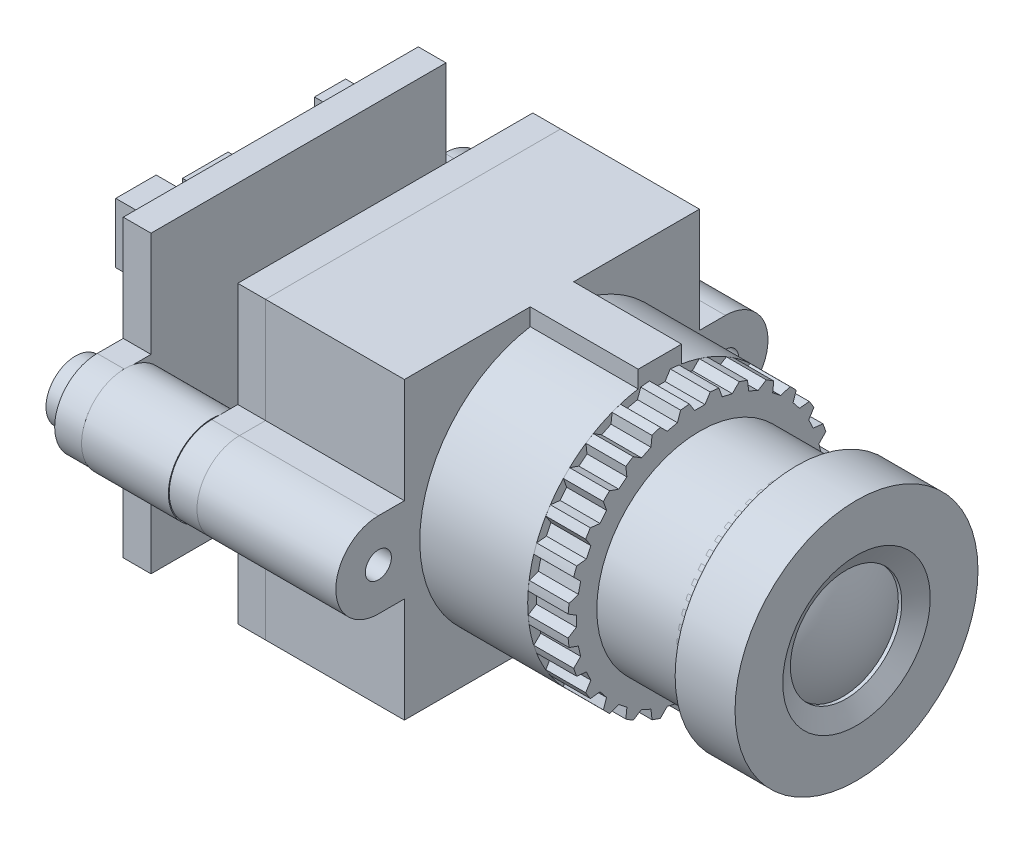
from build123d import *

# Parameters (mm, degrees)
SKETCH1_R             = 7
BOSS_EXTRUDE1_DEPTH   = 3.45
SKETCH2_R             = 5.935
BOSS_EXTRUDE2_DEPTH   = 5.58
SKETCH3_R             = 7.61
BOSS_EXTRUDE3_DEPTH   = 2.3
SKETCH4_W             = 0.6
SKETCH4_H             = 4.25
CUT_EXTRUDE1_DEPTH    = 2.3
BOSS_EXTRUDE4_DEPTH   = 6.22
SKETCH7_R             = 0.75
BOSS_EXTRUDE5_DEPTH   = 8
SKETCH8_R             = 0.75
BOSS_EXTRUDE6_DEPTH   = 1.6
SKETCH9_R             = 2.5
SKETCH9_R_2           = 1
BOSS_EXTRUDE7_DEPTH   = 5
BOSS_EXTRUDE7_2_DEPTH = 5
SKETCH10_R            = 0.75
BOSS_EXTRUDE8_DEPTH   = 1.6
SKETCH11_W            = 7
SKETCH11_H            = 3.2
BOSS_EXTRUDE9_DEPTH   = 4.8
SKETCH12_W            = 6.3
SKETCH12_H            = 2.5
CUT_EXTRUDE2_DEPTH    = 4.4
SKETCH13_W            = 4.8
SKETCH13_H            = 0.35
CUT_EXTRUDE3_DEPTH    = 1.5
SKETCH14_W            = 2.3306508
SKETCH14_H            = 3.458981743
SKETCH14_W_2          = 2.293656343
SKETCH14_H_2          = 3.939909685
SKETCH14_W_3          = 1.627756114
SKETCH14_H_3          = 1.923711771
SKETCH14_W_4          = 4.2728598
SKETCH14_H_4          = 1.960706228
SKETCH14_W_5          = 1.794231171
SKETCH14_H_5          = 2.793081515
SKETCH14_W_6          = 2.626606457
SKETCH14_H_6          = 1.331800458
BOSS_EXTRUDE10_DEPTH  = 2.2
SKETCH15_R            = 1.7
BOSS_EXTRUDE11_DEPTH  = 1.25
SKETCH16_R            = 5.935
BOSS_EXTRUDE12_DEPTH  = 1


with BuildPart() as part:
    # Sketch1 → Boss-Extrude1 (new body)
    with BuildSketch(Plane(origin=(0, 0, 0), x_dir=(0, 0, -1), z_dir=(1, 0, 0))):
        Circle(SKETCH1_R)
    extrude(amount=-BOSS_EXTRUDE1_DEPTH)

    # Sketch2 → Boss-Extrude2 (add)
    with BuildSketch(Plane.ZY.offset(3.45)):
        with Locations(Location((0, 0, 0), (0, 0, 180))):
            Circle(SKETCH2_R)
    extrude(amount=BOSS_EXTRUDE2_DEPTH)

    # Sketch3 → Boss-Extrude3 (add)
    with BuildSketch(Plane.ZY.offset(9.03)):
        Circle(SKETCH3_R)
    extrude(amount=BOSS_EXTRUDE3_DEPTH)

    # Sketch4 → Cut-Revolve7 (revolve, cut)
    with BuildSketch(Plane.XY, mode=Mode.PRIVATE) as cut_revolve7_sk:
        with BuildLine():
            Line((-0.6, 2.803361203), (-0.6, 3.210769515))
            Line((-0.6, 3.210769515), (-0.8, 3.210769515))
            add(Edge.make_bspline(
                [(-0.6, 2.803361203), (-0.692820323, 3.008825328), (-0.8, 3.210769515)],
                knots=[0.866025404, 0.866025404, 0.866025404, 1, 1, 1], degree=2))
        make_face()
        with Locations((0.3, 2.125)):
            Rectangle(SKETCH4_W, SKETCH4_H)
        with BuildLine():
            Line((0, 0), (0, 4.25))
            Line((0, 4.25), (-0.6, 3.210769515))
            Line((-0.6, 3.210769515), (-0.6, 2.803361203))
            add(Edge.make_bspline(
                [(0, 0), (0, 1.475220219), (-0.6, 2.803361203)],
                knots=[0, 0, 0, 0.866025404, 0.866025404, 0.866025404], degree=2))
        make_face()
    revolve(cut_revolve7_sk.sketch.rotate(Axis((-11.8965, 0, 0), (1, 0, 0)), 90), axis=Axis((-11.8965, 0, 0), (1, 0, 0)), mode=Mode.SUBTRACT)

    # Sketch5 → Cut-Extrude1 (cut)
    with BuildSketch(Plane(origin=(-9.03, 0, 0), x_dir=(0, 0, -1), z_dir=(1, 0, 0))):
        with BuildLine():
            ThreePointArc((3.832157886, 6.574698923), (3.301855255, 6.856373085), (2.750995245, 7.09535941))
            Line((2.750995245, 7.09535941), (2.814622725, 6.536053773))
            Line((2.814622725, 6.536053773), (3.355204045, 6.275723529))
            Line((3.355204045, 6.275723529), (3.832157886, 6.574698923))
        make_face()
        with BuildLine():
            ThreePointArc((2.273069542, 7.262592847), (1.693384307, 7.419201412), (1.103156048, 7.529617967))
            Line((1.103156048, 7.529617967), (1.289645467, 6.998493736))
            Line((1.289645467, 6.998493736), (1.874602214, 6.864981175))
            Line((1.874602214, 6.864981175), (2.273069542, 7.262592847))
        make_face()
        with BuildLine():
            ThreePointArc((0.6, 7.586310038), (0.300233748, 7.604075203), (0, 7.61))
            Line((0, 7.61), (0, 7.11))
            Line((0, 7.11), (0.3, 7.11))
            Line((0.3, 7.11), (0.6, 7.586310038))
        make_face()
        with BuildLine():
            Line((-1.289645467, 6.998493736), (-1.103156048, 7.529617967))
            ThreePointArc((-1.103156048, 7.529617967), (-1.693384307, 7.419201412), (-2.273069542, 7.262592847))
            Line((-2.273069542, 7.262592847), (-1.874602214, 6.864981175))
            Line((-1.874602214, 6.864981175), (-1.289645467, 6.998493736))
        make_face()
        with BuildLine():
            Line((0, 7.11), (0, 7.61))
            ThreePointArc((0, 7.61), (-0.300233748, 7.604075203), (-0.6, 7.586310038))
            Line((-0.6, 7.586310038), (-0.3, 7.11))
            Line((-0.3, 7.11), (0, 7.11))
        make_face()
        with BuildLine():
            Line((-2.814622725, 6.536053773), (-2.750995245, 7.09535941))
            ThreePointArc((-2.750995245, 7.09535941), (-3.301855255, 6.856373085), (-3.832157886, 6.574698923))
            Line((-3.832157886, 6.574698923), (-3.355204045, 6.275723529))
            Line((-3.355204045, 6.275723529), (-2.814622725, 6.536053773))
        make_face()
        with BuildLine():
            Line((-4.198463046, 5.745868781), (-4.260888053, 6.305309905))
            ThreePointArc((-4.260888053, 6.305309905), (-4.744757392, 5.949737582), (-5.199085832, 5.557122143))
            Line((-5.199085832, 5.557122143), (-4.667561936, 5.3717749))
            Line((-4.667561936, 5.3717749), (-4.198463046, 5.745868781))
        make_face()
        with BuildLine():
            Line((-5.3717749, 4.667561936), (-5.557122143, 5.199085832))
            ThreePointArc((-5.557122143, 5.199085832), (-5.949737582, 4.744757392), (-6.305309905, 4.260888053))
            Line((-6.305309905, 4.260888053), (-5.745868781, 4.198463046))
            Line((-5.745868781, 4.198463046), (-5.3717749, 4.667561936))
        make_face()
        with BuildLine():
            Line((-6.275723529, 3.355204045), (-6.574698923, 3.832157886))
            ThreePointArc((-6.574698923, 3.832157886), (-6.856373085, 3.301855255), (-7.09535941, 2.750995245))
            Line((-7.09535941, 2.750995245), (-6.536053773, 2.814622725))
            Line((-6.536053773, 2.814622725), (-6.275723529, 3.355204045))
        make_face()
        with BuildLine():
            Line((-6.864981175, 1.874602214), (-7.262592847, 2.273069542))
            ThreePointArc((-7.262592847, 2.273069542), (-7.419201412, 1.693384307), (-7.529617967, 1.103156048))
            Line((-7.529617967, 1.103156048), (-6.998493736, 1.289645467))
            Line((-6.998493736, 1.289645467), (-6.864981175, 1.874602214))
        make_face()
        with BuildLine():
            Line((-7.11, 0.3), (-7.586310038, 0.6))
            ThreePointArc((-7.586310038, 0.6), (-7.61, 0), (-7.586310038, -0.6))
            Line((-7.586310038, -0.6), (-7.11, -0.3))
            Line((-7.11, -0.3), (-7.11, 0.3))
        make_face()
        with BuildLine():
            ThreePointArc((-7.529617967, -1.103156048), (-7.419201412, -1.693384307), (-7.262592847, -2.273069542))
            Line((-7.262592847, -2.273069542), (-6.864981175, -1.874602214))
            Line((-6.864981175, -1.874602214), (-6.998493736, -1.289645467))
            Line((-6.998493736, -1.289645467), (-7.529617967, -1.103156048))
        make_face()
        with BuildLine():
            ThreePointArc((-7.09535941, -2.750995245), (-6.856373085, -3.301855255), (-6.574698923, -3.832157886))
            Line((-6.574698923, -3.832157886), (-6.275723529, -3.355204045))
            Line((-6.275723529, -3.355204045), (-6.536053773, -2.814622725))
            Line((-6.536053773, -2.814622725), (-7.09535941, -2.750995245))
        make_face()
        with BuildLine():
            ThreePointArc((-6.305309905, -4.260888053), (-5.949737582, -4.744757392), (-5.557122143, -5.199085832))
            Line((-5.557122143, -5.199085832), (-5.3717749, -4.667561936))
            Line((-5.3717749, -4.667561936), (-5.745868781, -4.198463046))
            Line((-5.745868781, -4.198463046), (-6.305309905, -4.260888053))
        make_face()
        with BuildLine():
            ThreePointArc((-3.832157886, -6.574698923), (-3.301855255, -6.856373085), (-2.750995245, -7.09535941))
            Line((-2.750995245, -7.09535941), (-2.814622725, -6.536053773))
            Line((-2.814622725, -6.536053773), (-3.355204045, -6.275723529))
            Line((-3.355204045, -6.275723529), (-3.832157886, -6.574698923))
        make_face()
        with BuildLine():
            ThreePointArc((-5.199085832, -5.557122143), (-4.744757392, -5.949737582), (-4.260888053, -6.305309905))
            Line((-4.260888053, -6.305309905), (-4.198463046, -5.745868781))
            Line((-4.198463046, -5.745868781), (-4.667561936, -5.3717749))
            Line((-4.667561936, -5.3717749), (-5.199085832, -5.557122143))
        make_face()
        with BuildLine():
            ThreePointArc((-2.273069542, -7.262592847), (-1.693384307, -7.419201412), (-1.103156048, -7.529617967))
            Line((-1.103156048, -7.529617967), (-1.289645467, -6.998493736))
            Line((-1.289645467, -6.998493736), (-1.874602214, -6.864981175))
            Line((-1.874602214, -6.864981175), (-2.273069542, -7.262592847))
        make_face()
        with BuildLine():
            Line((0, -7.61), (0, -7.11))
            Line((0, -7.11), (-0.3, -7.11))
            Line((-0.3, -7.11), (-0.6, -7.586310038))
            ThreePointArc((-0.6, -7.586310038), (-0.300233748, -7.604075203), (0, -7.61))
        make_face()
        with BuildLine():
            Line((0.3, -7.11), (0, -7.11))
            Line((0, -7.11), (0, -7.61))
            ThreePointArc((0, -7.61), (0.300233748, -7.604075203), (0.6, -7.586310038))
            Line((0.6, -7.586310038), (0.3, -7.11))
        make_face()
        with BuildLine():
            Line((1.289645467, -6.998493736), (1.103156048, -7.529617967))
            ThreePointArc((1.103156048, -7.529617967), (1.693384307, -7.419201412), (2.273069542, -7.262592847))
            Line((2.273069542, -7.262592847), (1.874602214, -6.864981175))
            Line((1.874602214, -6.864981175), (1.289645467, -6.998493736))
        make_face()
        with BuildLine():
            Line((2.814622725, -6.536053773), (2.750995245, -7.09535941))
            ThreePointArc((2.750995245, -7.09535941), (3.301855255, -6.856373085), (3.832157886, -6.574698923))
            Line((3.832157886, -6.574698923), (3.355204045, -6.275723529))
            Line((3.355204045, -6.275723529), (2.814622725, -6.536053773))
        make_face()
        with BuildLine():
            Line((4.198463046, -5.745868781), (4.260888053, -6.305309905))
            ThreePointArc((4.260888053, -6.305309905), (4.744757392, -5.949737582), (5.199085832, -5.557122143))
            Line((5.199085832, -5.557122143), (4.667561936, -5.3717749))
            Line((4.667561936, -5.3717749), (4.198463046, -5.745868781))
        make_face()
        with BuildLine():
            Line((5.3717749, -4.667561936), (5.557122143, -5.199085832))
            ThreePointArc((5.557122143, -5.199085832), (5.949737582, -4.744757392), (6.305309905, -4.260888053))
            Line((6.305309905, -4.260888053), (5.745868781, -4.198463046))
            Line((5.745868781, -4.198463046), (5.3717749, -4.667561936))
        make_face()
        with BuildLine():
            Line((6.275723529, -3.355204045), (6.574698923, -3.832157886))
            ThreePointArc((6.574698923, -3.832157886), (6.856373085, -3.301855255), (7.09535941, -2.750995245))
            Line((7.09535941, -2.750995245), (6.536053773, -2.814622725))
            Line((6.536053773, -2.814622725), (6.275723529, -3.355204045))
        make_face()
        with BuildLine():
            Line((6.864981175, -1.874602214), (7.262592847, -2.273069542))
            ThreePointArc((7.262592847, -2.273069542), (7.419201412, -1.693384307), (7.529617967, -1.103156048))
            Line((7.529617967, -1.103156048), (6.998493736, -1.289645467))
            Line((6.998493736, -1.289645467), (6.864981175, -1.874602214))
        make_face()
        with BuildLine():
            ThreePointArc((7.61, 0), (7.604075203, 0.300233748), (7.586310038, 0.6))
            Line((7.586310038, 0.6), (7.11, 0.3))
            Line((7.11, 0.3), (7.11, -0.3))
            Line((7.11, -0.3), (7.586310038, -0.6))
            ThreePointArc((7.586310038, -0.6), (7.604075203, -0.300233748), (7.61, 0))
        make_face()
        with BuildLine():
            ThreePointArc((7.529617967, 1.103156048), (7.419201412, 1.693384307), (7.262592847, 2.273069542))
            Line((7.262592847, 2.273069542), (6.864981175, 1.874602214))
            Line((6.864981175, 1.874602214), (6.998493736, 1.289645467))
            Line((6.998493736, 1.289645467), (7.529617967, 1.103156048))
        make_face()
        with BuildLine():
            ThreePointArc((7.09535941, 2.750995245), (6.856373085, 3.301855255), (6.574698923, 3.832157886))
            Line((6.574698923, 3.832157886), (6.275723529, 3.355204045))
            Line((6.275723529, 3.355204045), (6.536053773, 2.814622725))
            Line((6.536053773, 2.814622725), (7.09535941, 2.750995245))
        make_face()
        with BuildLine():
            ThreePointArc((6.305309905, 4.260888053), (5.949737582, 4.744757392), (5.557122143, 5.199085832))
            Line((5.557122143, 5.199085832), (5.3717749, 4.667561936))
            Line((5.3717749, 4.667561936), (5.745868781, 4.198463046))
            Line((5.745868781, 4.198463046), (6.305309905, 4.260888053))
        make_face()
        with BuildLine():
            ThreePointArc((5.199085832, 5.557122143), (4.744757392, 5.949737582), (4.260888053, 6.305309905))
            Line((4.260888053, 6.305309905), (4.198463046, 5.745868781))
            Line((4.198463046, 5.745868781), (4.667561936, 5.3717749))
            Line((4.667561936, 5.3717749), (5.199085832, 5.557122143))
        make_face()
    extrude(amount=-CUT_EXTRUDE1_DEPTH, mode=Mode.SUBTRACT)

    # Sketch6 → Boss-Extrude4 (add)
    with BuildSketch(Plane.ZY.offset(11.33)):
        with BuildLine():
            ThreePointArc((1.25, 7.511705865), (0, 7.615), (-1.25, 7.511705865))
            Line((-1.25, 7.511705865), (1.25, 7.511705865))
        make_face()
        with BuildLine():
            Line((1.25, 7.511705865), (-1.25, 7.511705865))
            ThreePointArc((-1.25, 7.511705865), (-4.922878985, -5.809775168), (7.615, 0))
            ThreePointArc((7.615, 0), (5.809775168, 4.922878985), (1.25, 7.511705865))
        make_face()
        with BuildLine():
            Line((1.25, 8.5), (-1.25, 8.5))
            Line((-1.25, 8.5), (-1.25, 7.511705865))
            ThreePointArc((-1.25, 7.511705865), (0, 7.615), (1.25, 7.511705865))
            Line((1.25, 7.511705865), (1.25, 8.5))
        make_face()
    extrude(amount=BOSS_EXTRUDE4_DEPTH)

    # Sketch7 → Boss-Extrude5 (add)
    with BuildSketch(Plane.ZY.offset(17.55)):
        with BuildLine():
            Line((-8.5, 8.5), (-8.5, 2.45))
            Line((-8.5, 2.45), (-10, 2.45))
            ThreePointArc((-10, 2.45), (-12.45, 0), (-10, -2.45))
            Line((-10, -2.45), (-8.5, -2.45))
            Line((-8.5, -2.45), (-8.5, -8.5))
            Line((-8.5, -8.5), (8.5, -8.5))
            Line((8.5, -8.5), (8.5, -2.45))
            Line((8.5, -2.45), (10, -2.45))
            ThreePointArc((10, -2.45), (12.45, 0), (10, 2.45))
            Line((10, 2.45), (8.5, 2.45))
            Line((8.5, 2.45), (8.5, 8.5))
            Line((8.5, 8.5), (-8.5, 8.5))
        make_face()
        with Locations((-10, 0)):
            Circle(SKETCH7_R, mode=Mode.SUBTRACT)
        with Locations((10, 0)):
            Circle(SKETCH7_R, mode=Mode.SUBTRACT)
    extrude(amount=BOSS_EXTRUDE5_DEPTH)


with BuildPart() as body_2:
    # Sketch8 → Boss-Extrude6 (new body)
    with BuildSketch(Plane.ZY.offset(25.55)):
        with BuildLine():
            Line((-10, -2.45), (-8.5, -2.45))
            Line((-8.5, -2.45), (-8.5, -8.5))
            Line((-8.5, -8.5), (8.5, -8.5))
            Line((8.5, -8.5), (8.5, -2.45))
            Line((8.5, -2.45), (10, -2.45))
            ThreePointArc((10, -2.45), (12.45, 0), (10, 2.45))
            Line((10, 2.45), (8.5, 2.45))
            Line((8.5, 2.45), (8.5, 8.5))
            Line((8.5, 8.5), (-8.5, 8.5))
            Line((-8.5, 8.5), (-8.5, 2.45))
            Line((-8.5, 2.45), (-10, 2.45))
            ThreePointArc((-10, 2.45), (-12.45, 0), (-10, -2.45))
        make_face()
        with Locations((10, 0)):
            Circle(SKETCH8_R, mode=Mode.SUBTRACT)
        with Locations((-10, 0)):
            Circle(SKETCH8_R, mode=Mode.SUBTRACT)
    extrude(amount=BOSS_EXTRUDE6_DEPTH)


with BuildPart() as body_3:
    # Sketch9 → Boss-Extrude7 (new body)
    with BuildSketch(Plane.ZY.offset(27.15)):
        with Locations((-10, 0)):
            Circle(SKETCH9_R)
        with Locations((-10, 0)):
            Circle(SKETCH9_R_2, mode=Mode.SUBTRACT)
    extrude(amount=BOSS_EXTRUDE7_DEPTH)


with BuildPart() as body_4:
    # Sketch9 → Boss-Extrude7 2 (new body)
    with BuildSketch(Plane.ZY.offset(27.15)):
        with Locations(Location((10, 0, 0), (0, 0, 180))):
            Circle(SKETCH9_R)
        with Locations(Location((10, 0, 0), (0, 0, 180))):
            Circle(SKETCH9_R_2, mode=Mode.SUBTRACT)
    extrude(amount=BOSS_EXTRUDE7_2_DEPTH)


with BuildPart() as body_5:
    # Sketch10 → Boss-Extrude8 (new body)
    with BuildSketch(Plane.ZY.offset(32.15)):
        with BuildLine():
            Line((-10, -2.45), (-8.5, -2.45))
            Line((-8.5, -2.45), (-8.5, -8.5))
            Line((-8.5, -8.5), (8.5, -8.5))
            Line((8.5, -8.5), (8.5, -2.45))
            Line((8.5, -2.45), (10, -2.45))
            ThreePointArc((10, -2.45), (12.45, 0), (10, 2.45))
            Line((10, 2.45), (8.5, 2.45))
            Line((8.5, 2.45), (8.5, 8.5))
            Line((8.5, 8.5), (-8.5, 8.5))
            Line((-8.5, 8.5), (-8.5, 2.45))
            Line((-8.5, 2.45), (-10, 2.45))
            ThreePointArc((-10, 2.45), (-12.45, 0), (-10, -2.45))
        make_face()
        with Locations((10, 0)):
            Circle(SKETCH10_R, mode=Mode.SUBTRACT)
        with Locations((-10, 0)):
            Circle(SKETCH10_R, mode=Mode.SUBTRACT)
    extrude(amount=BOSS_EXTRUDE8_DEPTH)

    # Sketch14 → Boss-Extrude10 (add)
    with BuildSketch(Plane.ZY.offset(33.75)):
        with Locations((5.5676658, 5.724892243)):
            Rectangle(SKETCH14_W, SKETCH14_H)
        with Locations((4.772284972, -6.076339586)):
            Rectangle(SKETCH14_W_2, SKETCH14_H_2)
        with Locations((-1.738739486, -2.922562115)):
            Rectangle(SKETCH14_W_3, SKETCH14_H_3)
        with Locations((-1.267060157, 1.202319857)):
            Rectangle(SKETCH14_W_4, SKETCH14_H_4)
        with Locations((-5.613908872, 5.391942129)):
            Rectangle(SKETCH14_W_5, SKETCH14_H_5)
        with Locations((1.572264429, 5.863621457)):
            Rectangle(SKETCH14_W_6, SKETCH14_H_6)
    extrude(amount=BOSS_EXTRUDE10_DEPTH)

    # Sketch15 → Boss-Extrude11 (add)
    with BuildSketch(Plane.ZY.offset(33.75)):
        with Locations((-10, 0)):
            Circle(SKETCH15_R)
        with Locations((10, 0)):
            Circle(SKETCH15_R)
    extrude(amount=BOSS_EXTRUDE11_DEPTH)


with BuildPart() as body_6:
    # Sketch11 → Boss-Extrude9 (new body)
    with BuildSketch(Plane.ZY.offset(33.75)):
        with Locations((0, -6.3)):
            Rectangle(SKETCH11_W, SKETCH11_H)
    extrude(amount=BOSS_EXTRUDE9_DEPTH)

    # Sketch12 → Cut-Extrude2 (cut)
    with BuildSketch(Plane.ZY.offset(38.55)):
        with Locations((0, -6.3)):
            Rectangle(SKETCH12_W, SKETCH12_H)
    extrude(amount=-CUT_EXTRUDE2_DEPTH, mode=Mode.SUBTRACT)

    # Sketch13 → Cut-Extrude3 (cut)
    with BuildSketch(Plane.ZY.offset(38.55)):
        with Locations((0, -4.875)):
            Rectangle(SKETCH13_W, SKETCH13_H)
    extrude(amount=-CUT_EXTRUDE3_DEPTH, mode=Mode.SUBTRACT)


with BuildPart() as body_7:
    # Sketch16 → Boss-Extrude12 (new body)
    with BuildSketch(Plane.ZY.offset(3.45)):
        Circle(SKETCH16_R)
    extrude(amount=BOSS_EXTRUDE12_DEPTH)


solid = Compound([part.part, body_2.part, body_3.part, body_4.part, body_5.part, body_6.part, body_7.part])
